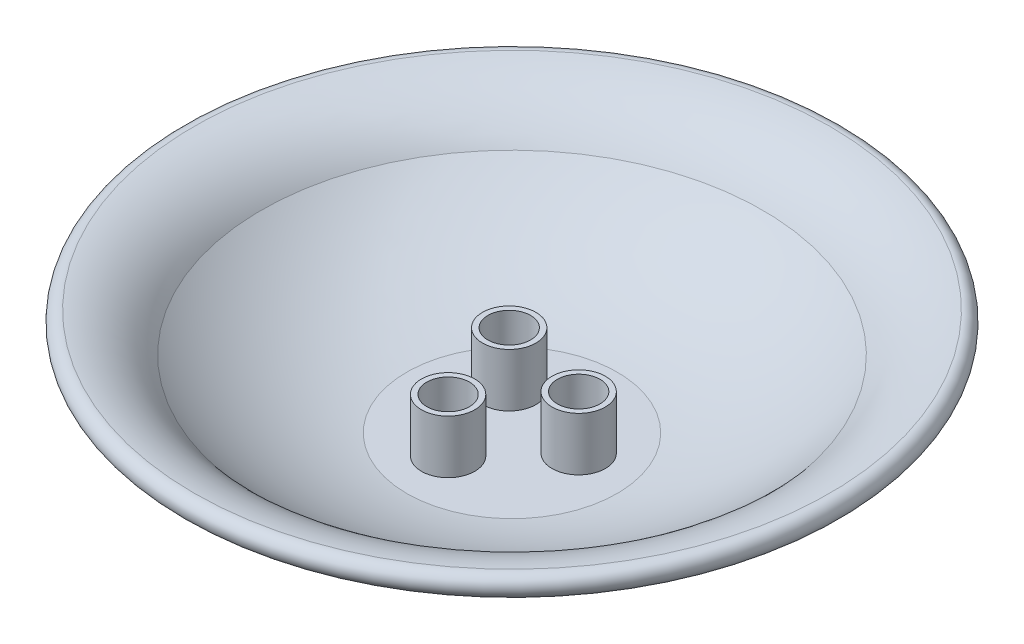
from build123d import *

# Parameters (mm, degrees)
SKETCH2_R           = 2.5
SKETCH2_R_2         = 2
BOSS_EXTRUDE2_DEPTH = 5
CUT_EXTRUDE1_START  = -5
SKETCH3_R           = 2
CUT_EXTRUDE1_DEPTH  = 5


with BuildPart() as part:
    # Sketch1 → Revolve1 (revolve)
    with BuildSketch(Plane.XY, mode=Mode.PRIVATE) as revolve1_sk:
        with BuildLine():
            Line((3.119266055, -4.816513761), (13.119266055, -4.816513761))
            Line((13.119266055, -4.816513761), (13.119266055, -2.816513761))
            Line((13.119266055, -2.816513761), (3.257916771, -2.816513761))
            ThreePointArc((3.257916771, -2.816513761), (-4.025816821, -0.658797724), (-10.372175668, 3.516396035))
            ThreePointArc((-10.372175668, 3.516396035), (-13.131249362, 6.018603225), (-16.672681055, 7.172635302))
            ThreePointArc((-16.672681055, 7.172635302), (-17.771282031, 6.282087215), (-16.880733945, 5.183486239))
            ThreePointArc((-16.880733945, 5.183486239), (-14.048292509, 4.237555299), (-11.880733945, 2.183486239))
            ThreePointArc((-11.880733945, 2.183486239), (-4.911005239, -2.452809391), (3.119266055, -4.816513761))
        make_face()
    revolve(revolve1_sk.sketch.rotate(Axis((13.119266055, -2.816513761, 0), (0, -1, 0)), 270), axis=Axis((13.119266055, -2.816513761, 0), (0, -1, 0)))

    # Sketch2 → Boss-Extrude2 (add)
    # profile 1 of 3: a face of its own
    with BuildSketch(Plane(origin=(0, -2.816513761, 0), x_dir=(1, 0, 0), z_dir=(0, 1, 0))):
        with Locations(Location((9.455762685, 3.402755216, 0), (0, 0, 270))):
            Circle(SKETCH2_R)
        with Locations(Location((9.455762685, 3.402755216, 0), (0, 0, 270))):
            Circle(SKETCH2_R_2, mode=Mode.SUBTRACT)
    # profile 2 of 3: a face of its own
    with BuildSketch(Plane(origin=(0, -2.816513761, 0), x_dir=(1, 0, 0), z_dir=(0, 1, 0))):
        with Locations(Location((17.8978902, 1.471309377, 0), (0, 0, 270))):
            Circle(SKETCH2_R)
        with Locations(Location((17.8978902, 1.471309377, 0), (0, 0, 270))):
            Circle(SKETCH2_R_2, mode=Mode.SUBTRACT)
    # profile 3 of 3: a face of its own
    with BuildSketch(Plane(origin=(0, -2.816513761, 0), x_dir=(1, 0, 0), z_dir=(0, 1, 0))):
        with Locations(Location((12.00414528, -4.874064593, 0), (0, 0, 270))):
            Circle(SKETCH2_R)
        with Locations(Location((12.00414528, -4.874064593, 0), (0, 0, 270))):
            Circle(SKETCH2_R_2, mode=Mode.SUBTRACT)
    extrude(amount=BOSS_EXTRUDE2_DEPTH)

    # Sketch3 → Cut-Extrude1 (cut)
    with BuildSketch(Plane(origin=(0, -2.816513761, 0), x_dir=(1, 0, 0), z_dir=(0, 1, 0)).offset(CUT_EXTRUDE1_START)):
        with Locations(Location((17.8978902, 1.471309377, 0), (0, 0, 90))):
            Circle(SKETCH3_R)
        with Locations(Location((12.00414528, -4.874064593, 0), (0, 0, 90))):
            Circle(SKETCH3_R)
        with Locations(Location((9.455762685, 3.402755216, 0), (0, 0, 90))):
            Circle(SKETCH3_R)
    extrude(amount=CUT_EXTRUDE1_DEPTH, mode=Mode.SUBTRACT)


solid = part.part
